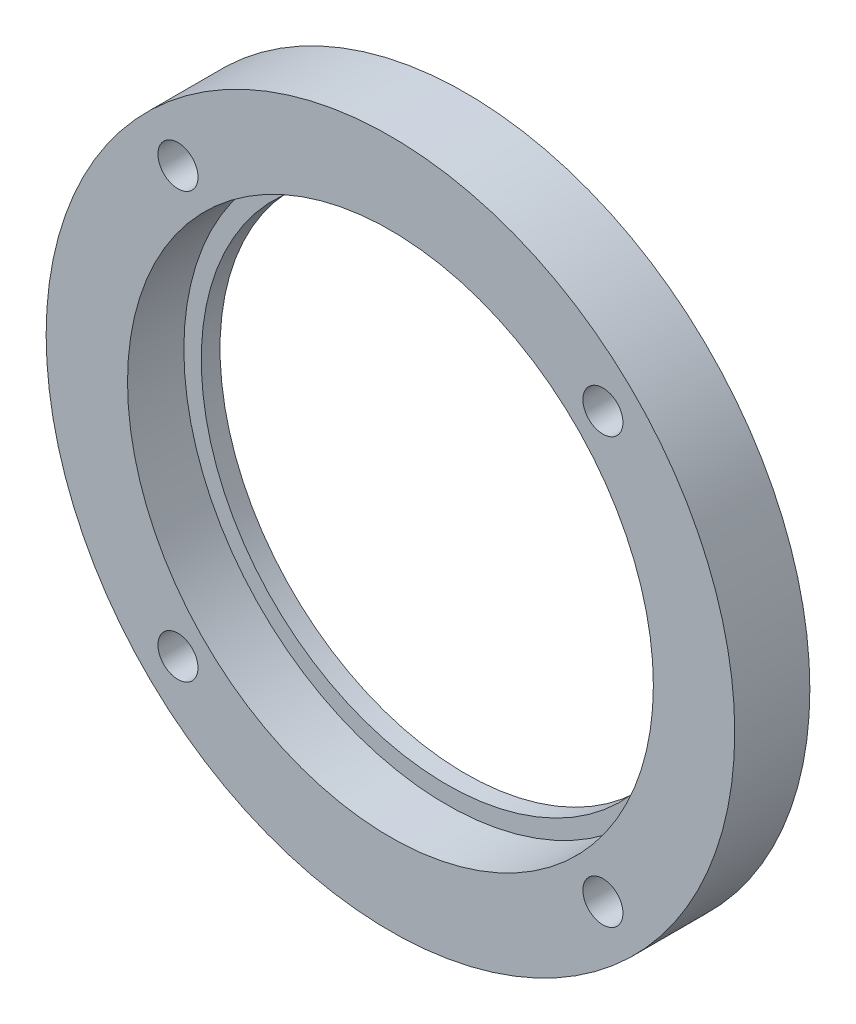
from build123d import *

# Parameters (mm, degrees)
SKETCH_1_R                   = 27.5
SKETCH_1_R_2                 = 21
EXTRUDE_1_DEPTH              = 6
SKETCH_1_3_R                 = 21
SKETCH_1_3_R_2               = 19.61
EXTRUDE_2_DEPTH              = 1.5
HOLE_WIZARD_M3_1_D           = 3.2
HOLE_WIZARD_M3_1_CSINK_D     = 6.3
HOLE_WIZARD_M3_1_CSINK_ANGLE = 90


with BuildPart() as part:
    # ｽｹｯﾁ1 → ﾎﾞｽ - 押し出し1 (new body)
    with BuildSketch(Plane.XY):
        Circle(SKETCH_1_R)
        Circle(SKETCH_1_R_2, mode=Mode.SUBTRACT)
    extrude(amount=EXTRUDE_1_DEPTH)

    # ｽｹｯﾁ1<3> → ﾎﾞｽ - 押し出し2 (add)
    with BuildSketch(Plane.XY):
        Circle(SKETCH_1_3_R)
        Circle(SKETCH_1_3_R_2, mode=Mode.SUBTRACT)
    extrude(amount=EXTRUDE_2_DEPTH)

    # M3 丸皿ねじ用皿穴1 (through all)
    with Locations(Plane(origin=(16.970562748, 16.970562748, 0), x_dir=(-1, 0, 0), z_dir=(0, 0, -1))):
        with Locations((0, 0), (33.941125496, 0), (33.941125496, -33.941125496), (0, -33.941125496)):
            CounterSinkHole(HOLE_WIZARD_M3_1_D / 2, HOLE_WIZARD_M3_1_CSINK_D / 2, counter_sink_angle=HOLE_WIZARD_M3_1_CSINK_ANGLE)


solid = part.part
